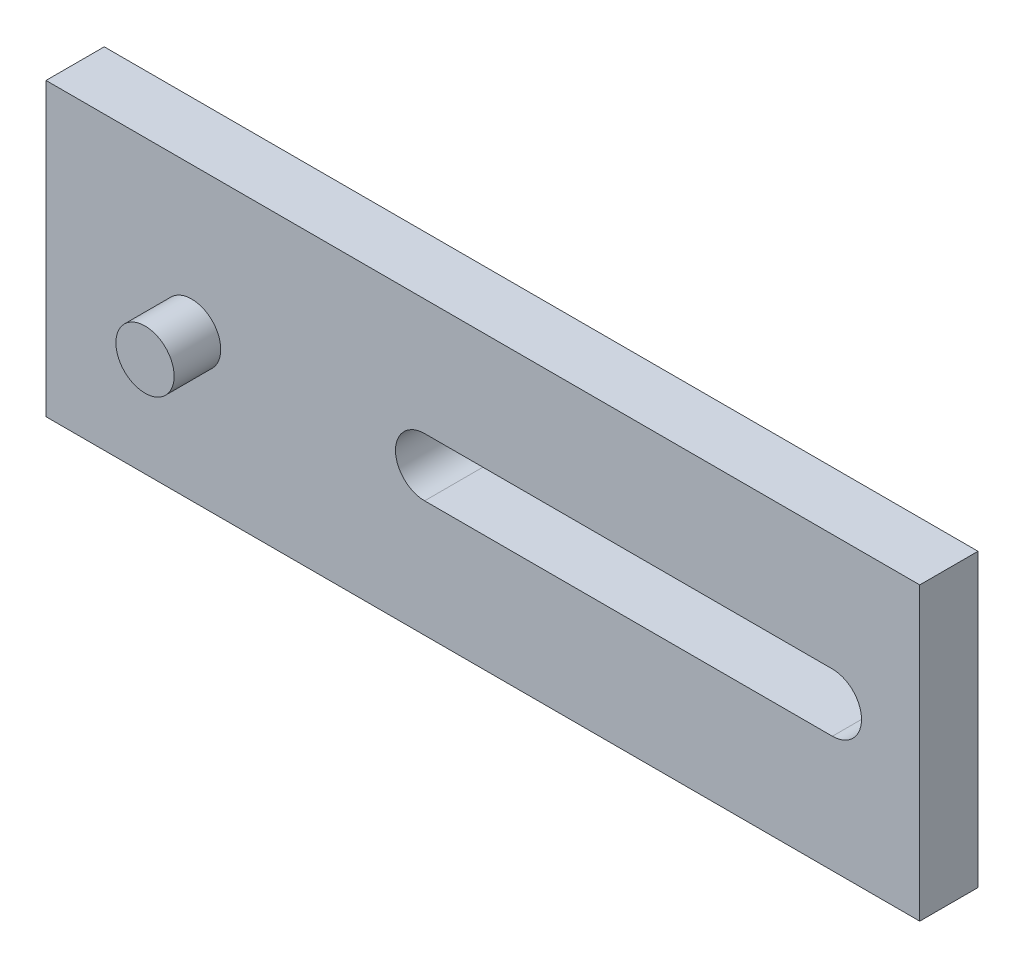
from build123d import *

# Parameters (mm, degrees)
CROQUIS3_W              = 150
CROQUIS3_H              = 50
SALIENTE_EXTRUIR3_DEPTH = 10
CROQUIS4_R              = 5
SALIENTE_EXTRUIR4_DEPTH = 8


with BuildPart() as part:
    # Croquis3 → Saliente-Extruir3 (new body)
    with BuildSketch(Plane.XY):
        Rectangle(CROQUIS3_W, CROQUIS3_H)
        with BuildLine():
            Line((60, 5), (-10, 5))
            ThreePointArc((-10, 5), (-15, 0), (-10, -5))
            Line((-10, -5), (60, -5))
            ThreePointArc((60, -5), (65, 0), (60, 5))
        make_face(mode=Mode.SUBTRACT)
    extrude(amount=SALIENTE_EXTRUIR3_DEPTH)

    # Croquis4 → Saliente-Extruir4 (add)
    with BuildSketch(Plane.XY.offset(10)):
        with Locations((-50, 0)):
            Circle(CROQUIS4_R)
    extrude(amount=SALIENTE_EXTRUIR4_DEPTH)


solid = part.part
